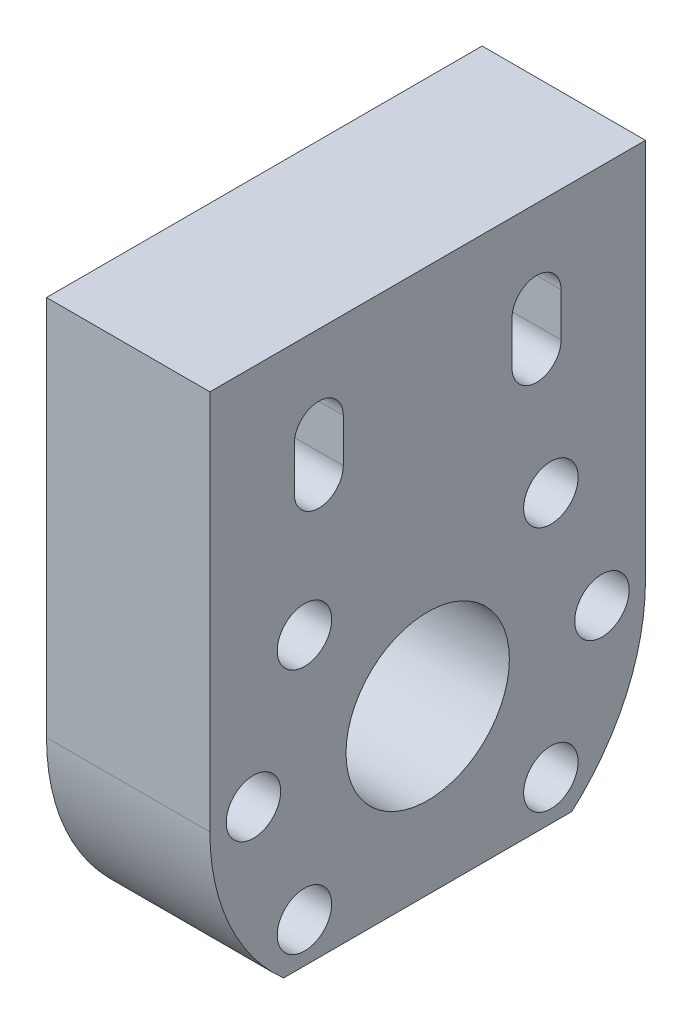
from build123d import *

# Parameters (mm, degrees)
SKETCH1_R           = 7.5
SKETCH1_R_2         = 2.5
BOSS_EXTRUDE1_DEPTH = 15


with BuildPart() as part:
    # Sketch1 → Boss-Extrude1 (new body)
    with BuildSketch(Plane(origin=(0, 0, 0), x_dir=(0, 0, -1), z_dir=(1, 0, 0))):
        with BuildLine():
            Line((-13.228756555, -15), (13.228756555, -15))
            ThreePointArc((13.228756555, -15), (18.228756555, -8.228756555), (20, 0))
            Line((20, 0), (20, 35))
            Line((20, 35), (-20, 35))
            Line((-20, 35), (-20, 0))
            ThreePointArc((-20, 0), (-18.228756555, -8.228756555), (-13.228756555, -15))
        make_face()
        Circle(SKETCH1_R, mode=Mode.SUBTRACT)
        with Locations((16, 0)):
            Circle(SKETCH1_R_2, mode=Mode.SUBTRACT)
        with Locations((11.313708499, -11.313708499)):
            Circle(SKETCH1_R_2, mode=Mode.SUBTRACT)
        with Locations((-11.313708499, -11.313708499)):
            Circle(SKETCH1_R_2, mode=Mode.SUBTRACT)
        with Locations((-16, 0)):
            Circle(SKETCH1_R_2, mode=Mode.SUBTRACT)
        with Locations((-11.313708499, 11.313708499)):
            Circle(SKETCH1_R_2, mode=Mode.SUBTRACT)
        with Locations((11.313708499, 11.313708499)):
            Circle(SKETCH1_R_2, mode=Mode.SUBTRACT)
        with BuildLine():
            Line((-12.25, 23), (-12.25, 27))
            ThreePointArc((-12.25, 27), (-10, 29.25), (-7.75, 27))
            Line((-7.75, 27), (-7.75, 23))
            ThreePointArc((-7.75, 23), (-10, 20.75), (-12.25, 23))
        make_face(mode=Mode.SUBTRACT)
        with BuildLine():
            Line((12.25, 23), (12.25, 27))
            ThreePointArc((12.25, 27), (10, 29.25), (7.75, 27))
            Line((7.75, 27), (7.75, 23))
            ThreePointArc((7.75, 23), (10, 20.75), (12.25, 23))
        make_face(mode=Mode.SUBTRACT)
    extrude(amount=BOSS_EXTRUDE1_DEPTH)


solid = part.part
